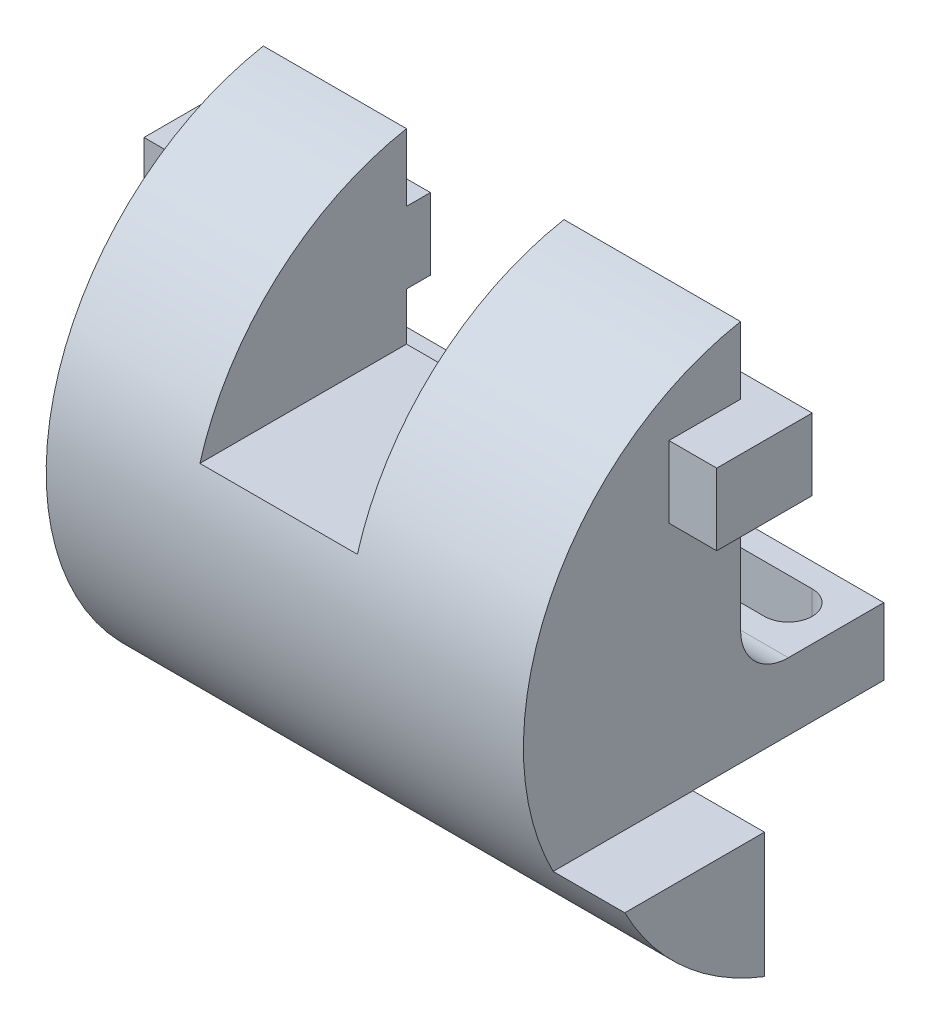
from build123d import *

# Parameters (mm, degrees)
BOSS_EXTRUDE1_DEPTH = 115
SKETCH4_W           = 110.804791126
SKETCH4_H           = 80.151186243
CUT_EXTRUDE1_DEPTH  = 15
SKETCH6_W           = 33
SKETCH6_H           = 45.5
CUT_EXTRUDE2_DEPTH  = 40
CUT_EXTRUDE3_DEPTH  = 144.740217058
SKETCH10_W          = 47
SKETCH10_H          = 20
SKETCH10_W_2        = 40
BOSS_EXTRUDE2_DEPTH = 15


with BuildPart() as part:
    # Sketch3 → Boss-Extrude1 (new body)
    with BuildSketch(Plane(origin=(0, 0, 0), x_dir=(0, 0, -1), z_dir=(1, 0, 0))):
        with BuildLine():
            Line((20, -35.767294724), (20, -49.872197862))
            Line((20, -49.872197862), (-20, -49.872197862))
            Line((-20, -49.872197862), (-20, -76.130091706))
            ThreePointArc((-20, -76.130091706), (-55.256322222, -19.163880915), (-10, 30.232705276))
            Line((-10, 30.232705276), (-10, -25.767294724))
            ThreePointArc((-10, -25.767294724), (-7.071067812, -32.838362535), (0, -35.767294724))
            Line((0, -35.767294724), (20, -35.767294724))
        make_face()
    extrude(amount=BOSS_EXTRUDE1_DEPTH)

    # Sketch4 → Cut-Extrude1 (cut)
    with BuildSketch(Plane(origin=(115, 0, 0), x_dir=(0, 0, -1), z_dir=(1, 0, 0))):
        with Locations((-10, -9.842887845)):
            Rectangle(SKETCH4_W, SKETCH4_H)
    extrude(amount=-CUT_EXTRUDE1_DEPTH, mode=Mode.SUBTRACT)

    # Sketch6 → Cut-Extrude2 (cut)
    with BuildSketch(Plane(origin=(0, 31.141039246, 0), x_dir=(1, 0, 0), z_dir=(0, 1, 0))):
        with Locations((46.5, -32.75)):
            Rectangle(SKETCH6_W, SKETCH6_H)
    extrude(amount=-CUT_EXTRUDE2_DEPTH, mode=Mode.SUBTRACT)

    # Sketch9 → Cut-Extrude3 (cut, through all)
    with BuildSketch(Plane(origin=(0, -35.767294724, 0), x_dir=(1, 0, 0), z_dir=(0, 1, 0))):
        with BuildLine():
            Line((90, 5), (10, 5))
            ThreePointArc((10, 5), (5, 10), (10, 15))
            Line((10, 15), (90, 15))
            ThreePointArc((90, 15), (95, 10), (90, 5))
        make_face()
    extrude(amount=-CUT_EXTRUDE3_DEPTH, mode=Mode.SUBTRACT)

    # Sketch10 → Boss-Extrude2 (add)
    with BuildSketch(Plane(origin=(0, 1.141039246, 0), x_dir=(1, 0, 0), z_dir=(0, 1, 0))):
        with Locations((86.5, -15)):
            Rectangle(SKETCH10_W, SKETCH10_H)
        with Locations((10, -15)):
            Rectangle(SKETCH10_W_2, SKETCH10_H)
    extrude(amount=BOSS_EXTRUDE2_DEPTH)


solid = part.part
